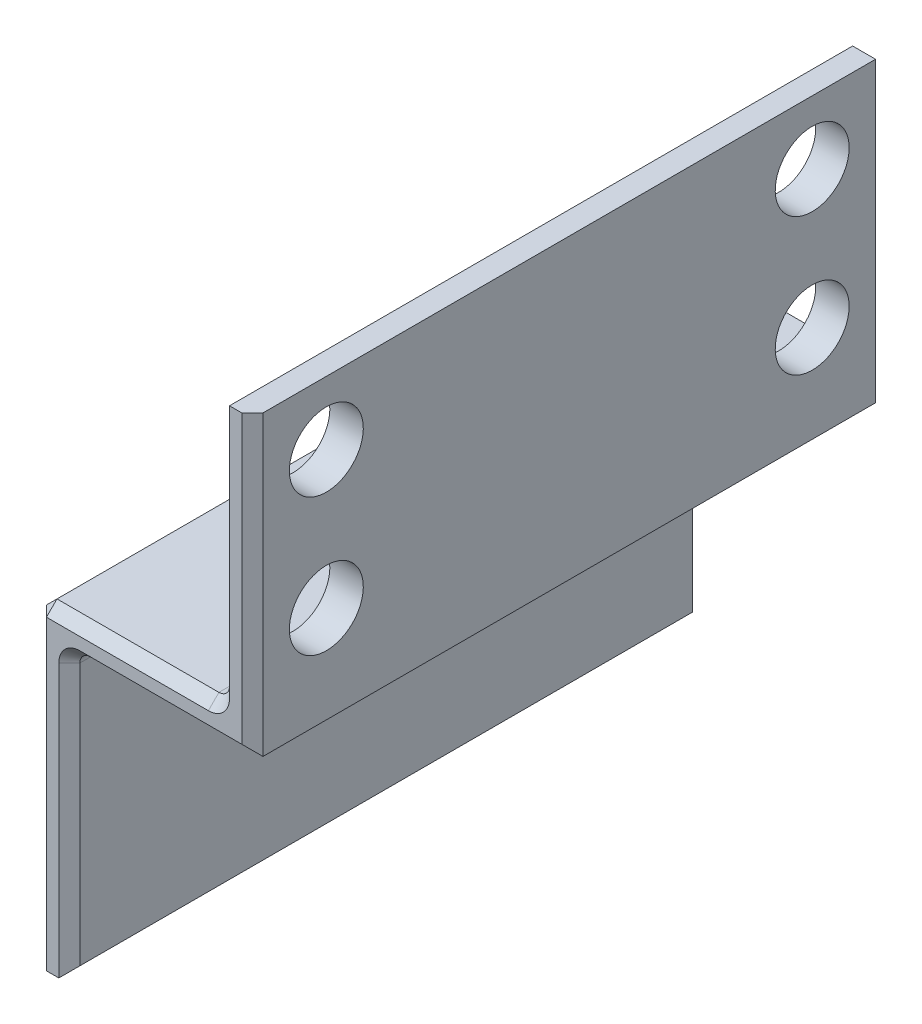
from build123d import *

# Parameters (mm, degrees)
SALIENTE_EXTRUIR1_DEPTH = 60
CROQUIS2_R              = 3.5
CORTAR_EXTRUIR1_DEPTH   = 60
REDONDEO1_R             = 1
CHAFL_N1_SIZE           = 1


with BuildPart() as part:
    # Croquis1 → Saliente-Extruir1 (new body)
    with BuildSketch(Plane.XY):
        Polygon((3.538389259, 50.854615385), (3.538389259, 25.854615385), (-13.791610741, 25.854615385), (-13.791610741, -4.145384615), (-10.621610741, -4.145384615), (-10.621610741, 22.684615385), (6.708389259, 22.684615385), (6.708389259, 50.854615385), align=None)
    extrude(amount=SALIENTE_EXTRUIR1_DEPTH)

    # Croquis2 → Cortar-Extruir1 (cut)
    with BuildSketch(Plane(origin=(6.708389259, 0, 0), x_dir=(0, 0, -1), z_dir=(1, 0, 0))):
        with Locations(Location((-53, 44.854615385, 0), (0, 0, 90))):
            Circle(CROQUIS2_R)
        with Locations(Location((-53, 31.854615385, 0), (0, 0, 90))):
            Circle(CROQUIS2_R)
        with Locations(Location((-7, 44.854615385, 0), (0, 0, 90))):
            Circle(CROQUIS2_R)
        with Locations(Location((-7, 31.854615385, 0), (0, 0, 90))):
            Circle(CROQUIS2_R)
    extrude(amount=-CORTAR_EXTRUIR1_DEPTH, mode=Mode.SUBTRACT)

    # Redondeo1
    redondeo1_edges = [part.edges().sort_by_distance(p)[0] for p in [
        (-10.621610741, 22.684615385, 30),
        (3.538389259, 25.854615385, 30),
    ]]
    fillet(redondeo1_edges, radius=REDONDEO1_R)

    # Chaflán1
    chafl_n1_edges = [part.edges().sort_by_distance(p)[0] for p in [
        (-13.791610741, 10.854615385, 0),
        (3.538389259, 38.854615385, 0),
        (5.123389259, 50.854615385, 0),
        (-10.621610741, -4.145384615, 30),
        (-13.791610741, -4.145384615, 30),
        (-13.791610741, 25.854615385, 30),
        (3.538389259, 50.854615385, 30),
        (-13.791610741, 10.854615385, 60),
        (-10.621610741, 8.769615385, 60),
        (6.708389259, 36.769615385, 60),
        (-1.456610741, 22.684615385, 0),
        (-1.456610741, 22.684615385, 60),
        (-5.626610741, 25.854615385, 0),
        (-5.626610741, 25.854615385, 60),
        (-10.328717522, 22.391722166, 0),
        (-10.328717522, 22.391722166, 60),
        (3.24549604, 26.147508603, 0),
        (3.24549604, 26.147508603, 60),
        (6.708389259, 36.769615385, 0),
        (3.538389259, 38.854615385, 60),
        (-10.621610741, 8.769615385, 0),
        (-12.206610741, -4.145384615, 0),
    ]]
    chamfer(chafl_n1_edges, length=CHAFL_N1_SIZE)


solid = part.part
